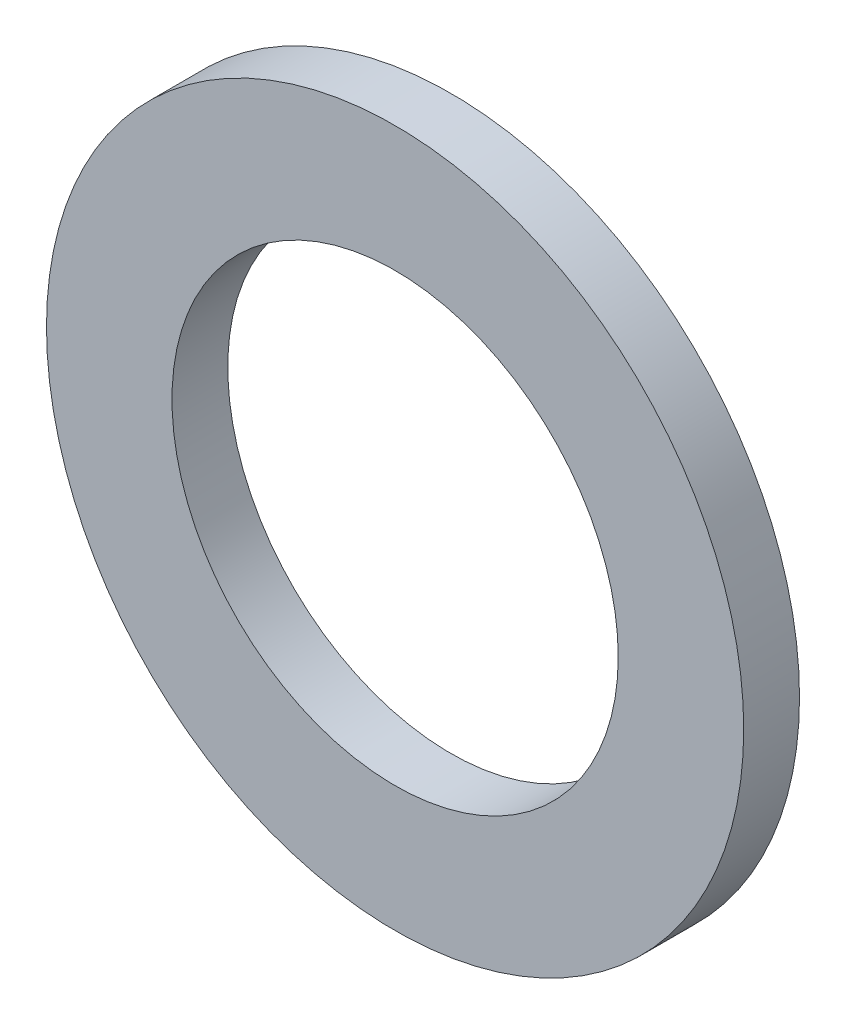
from build123d import *

# Parameters (mm, degrees)
SKETCH1_R           = 19.84375
SKETCH1_R_2         = 12.7
BOSS_EXTRUDE1_DEPTH = 3.175


with BuildPart() as part:
    # Sketch1 → Boss-Extrude1 (new body)
    with BuildSketch(Plane.XY):
        Circle(SKETCH1_R)
        Circle(SKETCH1_R_2, mode=Mode.SUBTRACT)
    extrude(amount=BOSS_EXTRUDE1_DEPTH)


solid = part.part
